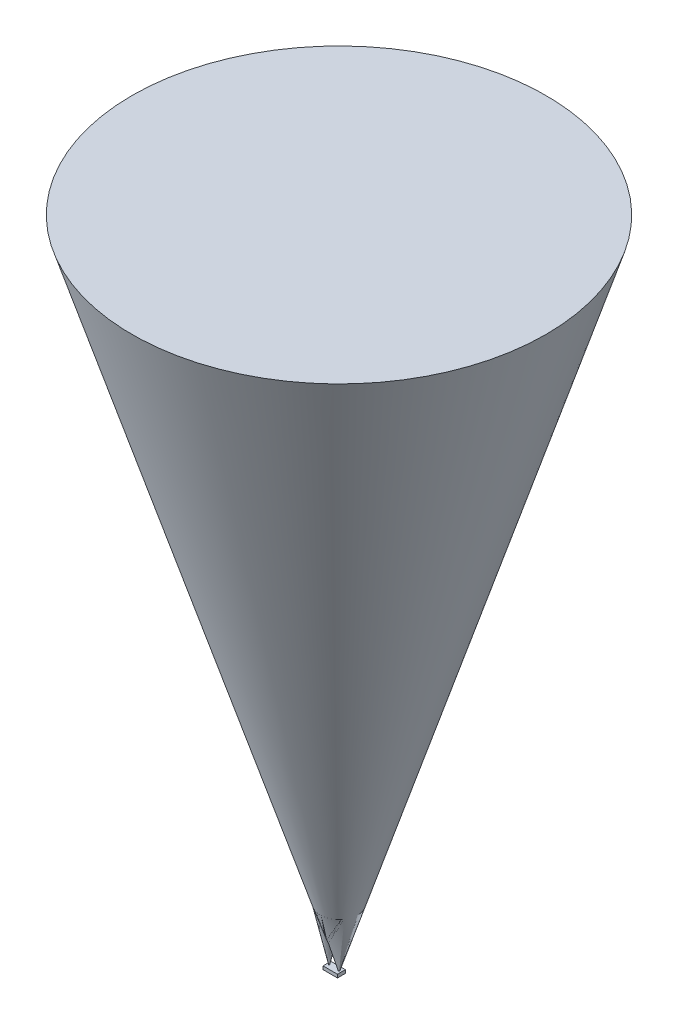
from build123d import *

# Parameters (mm, degrees)
SKETCH2_W           = 4.4
SKETCH2_H           = 2.4
SKETCH2_R           = 0.2
SKETCH2_R_2         = 0.1
BOSS_EXTRUDE1_DEPTH = 1


with BuildPart() as part:
    # Sketch2 → Boss-Extrude1 (new body)
    with BuildSketch(Plane(origin=(0, 0, 0), x_dir=(1, 0, 0), z_dir=(0, 1, 0))):
        Rectangle(SKETCH2_W, SKETCH2_H)
        with Locations(Location((1.465, 0, 0), (0, 0, 270))):
            Circle(SKETCH2_R, mode=Mode.SUBTRACT)
        with Locations(Location((-1.535, 0, 0), (0, 0, 270))):
            Circle(SKETCH2_R_2, mode=Mode.SUBTRACT)
    extrude(amount=BOSS_EXTRUDE1_DEPTH)


with BuildPart() as body_2:
    # Sketch3 → Revolve1 (revolve)
    with BuildSketch(Plane.XY, mode=Mode.PRIVATE) as revolve1_sk:
        Polygon((-1.535, 0.54892915), (-1.535, 200.54892915), (42.803932529, 200.54892915), align=None)
    revolve(revolve1_sk.sketch.rotate(Axis((-1.535, 0.54892915, 0), (0, 1, 0)), 270), axis=Axis((-1.535, 0.54892915, 0), (0, 1, 0)))

    # Sketch4 → Revolve2 (revolve)
    with BuildSketch(Plane.XY, mode=Mode.PRIVATE) as revolve2_sk:
        Polygon((1.465, 0.36568104), (64.582535683, 200.54892915), (1.465, 200.54892915), align=None)
    revolve(revolve2_sk.sketch.rotate(Axis((1.465, 0.36568104, 0), (0, 1, 0)), 180), axis=Axis((1.465, 0.36568104, 0), (0, 1, 0)))


solid = Compound([part.part, body_2.part])
